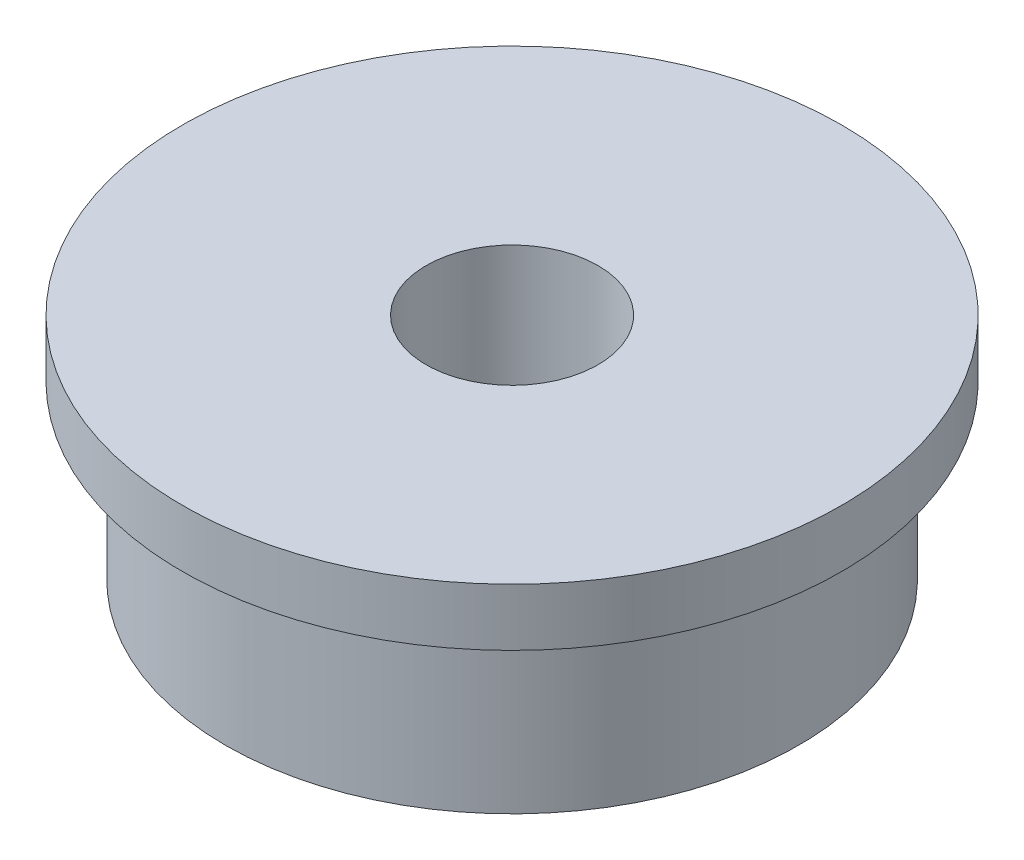
from build123d import *


with BuildPart() as part:
    # 草图1 → 旋转1 (revolve)
    with BuildSketch(Plane.XY, mode=Mode.PRIVATE) as revolve_1_sk:
        Polygon((1.5, 0), (1.5, 4), (5.75, 4), (5.75, 3), (5, 3), (5, 0), align=None)
    revolve(revolve_1_sk.sketch.rotate(Axis((0, 0, 0), (0, 1, 0)), 90), axis=Axis((0, 0, 0), (0, 1, 0)))


solid = part.part
